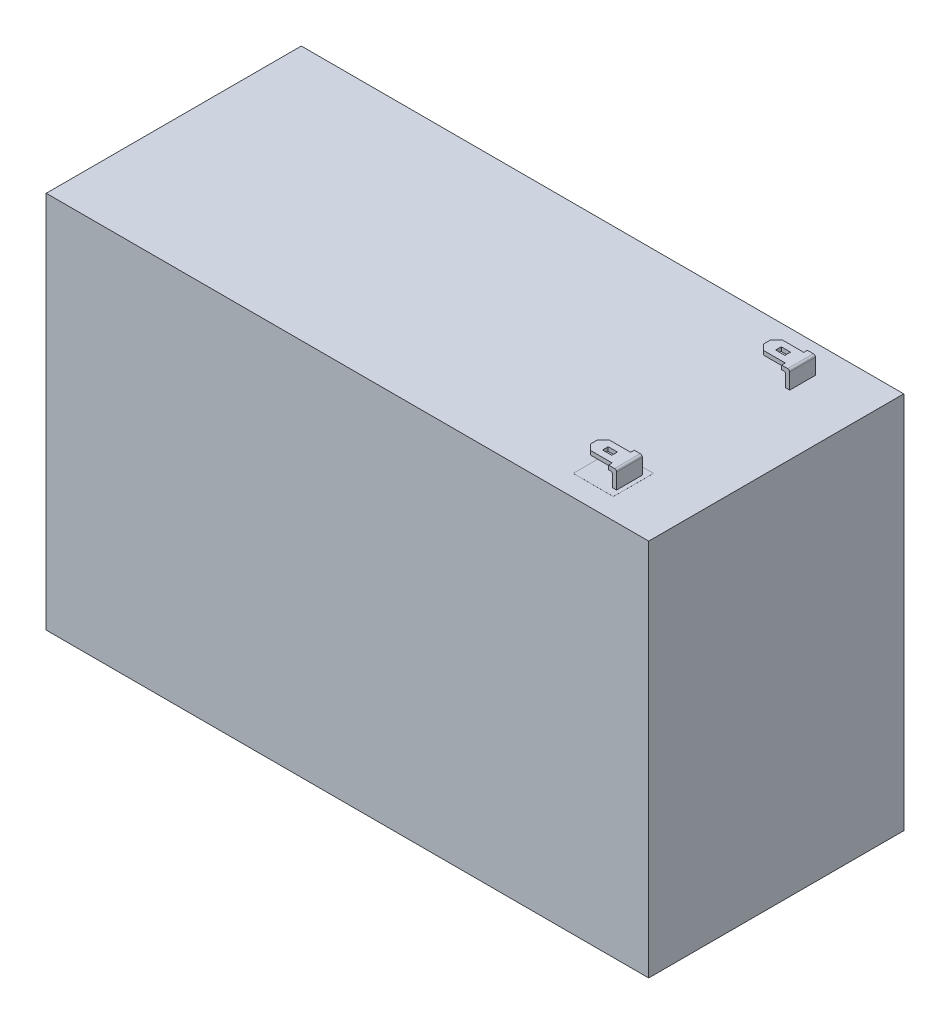
from build123d import *

# Parameters (mm, degrees)
SKETCH1_W           = 150
SKETCH1_H           = 63.5
BOSS_EXTRUDE1_DEPTH = 94.2
SKETCH3_W           = 2.3
SKETCH3_H           = 1.4
BOSS_EXTRUDE2_DEPTH = 4.4
SKETCH4_W           = 6.8
SKETCH4_H           = 3.4
CUT_EXTRUDE1_DEPTH  = 189.186636082
SKETCH5_W           = 10
SKETCH5_H           = 10
BOSS_EXTRUDE3_DEPTH = 0.01


with BuildPart() as part:
    # Sketch1 → Boss-Extrude1 (new body)
    with BuildSketch(Plane(origin=(0, 0, 0), x_dir=(1, 0, 0), z_dir=(0, 1, 0))):
        with Locations((75, 31.75)):
            Rectangle(SKETCH1_W, SKETCH1_H)
    extrude(amount=BOSS_EXTRUDE1_DEPTH)

    # Sketch3 → Boss-Extrude2 (add)
    with BuildSketch(Plane(origin=(0, 94.2, 0), x_dir=(1, 0, 0), z_dir=(0, 1, 0))):
        Polygon((135, 7), (135, 13.4), (133, 13.4), (133, 12.5), (127.6, 12.5), (126.2, 11.1), (126.2, 9.3), (127.6, 7.9), (133, 7.9), (133, 7), align=None)
        with Locations((130.15, 10.2)):
            Rectangle(SKETCH3_W, SKETCH3_H, mode=Mode.SUBTRACT)
    boss_extrude2 = extrude(amount=BOSS_EXTRUDE2_DEPTH)

    # Sketch4 → Cut-Extrude1 (cut, through all)
    with BuildSketch(Plane.XY.offset(-7)):
        with Locations((129.6, 95.9)):
            Rectangle(SKETCH4_W, SKETCH4_H)
        with BuildLine():
            Line((133, 94.2), (134, 94.2))
            Line((134, 94.2), (134, 97.1))
            ThreePointArc((134, 97.1), (133.853553391, 97.453553391), (133.5, 97.6))
            Line((133.5, 97.6), (133, 97.6))
            Line((133, 97.6), (133, 94.2))
        make_face()
        with BuildLine():
            ThreePointArc((134.5, 98.6), (134.853553391, 98.453553391), (135, 98.1))
            Line((135, 98.1), (135, 98.6))
            Line((135, 98.6), (134.5, 98.6))
        make_face()
    cut_extrude1 = extrude(amount=-CUT_EXTRUDE1_DEPTH, mode=Mode.SUBTRACT)

    # Mirror1: Boss-Extrude2, Cut-Extrude1 across plane
    add(boss_extrude2.mirror(Plane.XY.offset(-31.75)))
    add(cut_extrude1.mirror(Plane.XY.offset(-31.75)), mode=Mode.SUBTRACT)

    # Sketch5 → Boss-Extrude3 (add)
    with BuildSketch(Plane(origin=(0, 94.2, 0), x_dir=(1, 0, 0), z_dir=(0, 1, 0))):
        with Locations((131, 10.2)):
            Rectangle(SKETCH5_W, SKETCH5_H)
    extrude(amount=BOSS_EXTRUDE3_DEPTH)


solid = part.part
